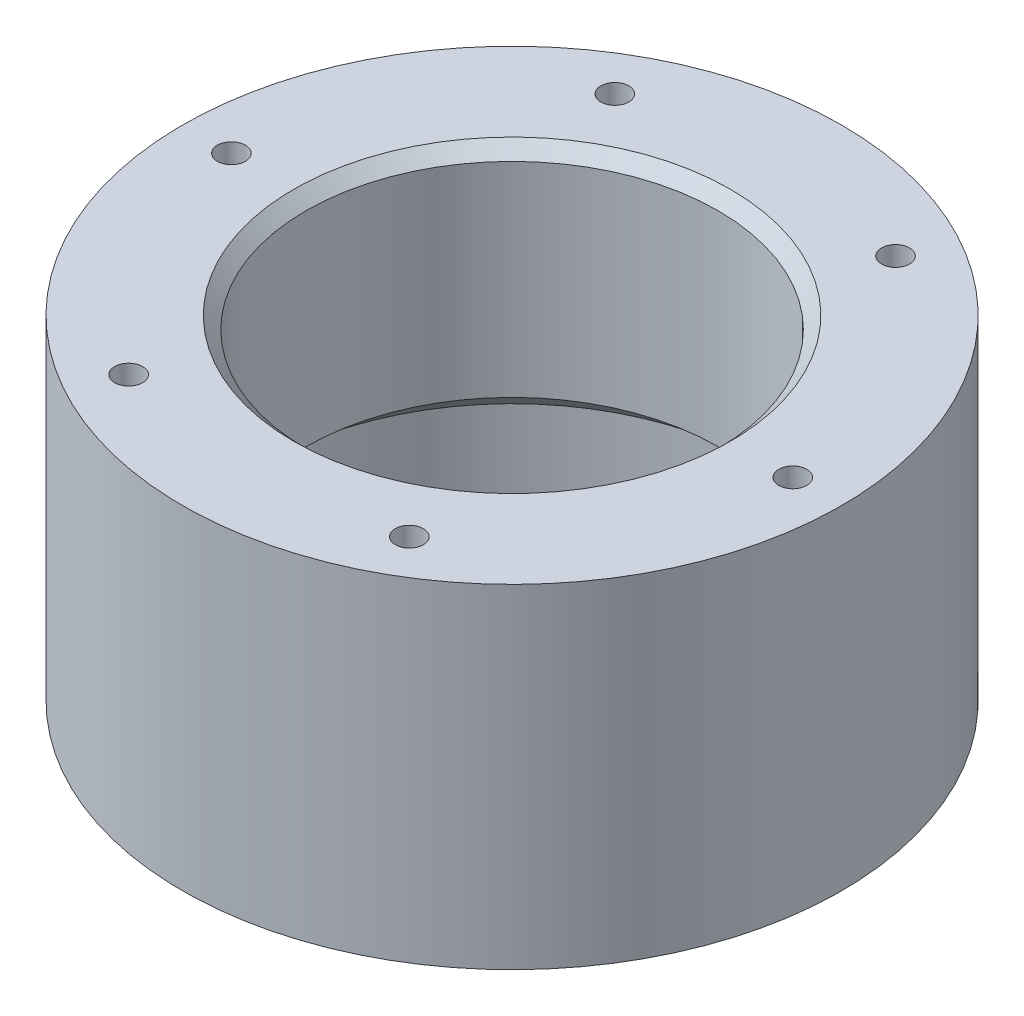
from build123d import *

# Parameters (mm, degrees)
OTW_R_GWINTOWANY_M81_D     = 6.8
OTW_R_GWINTOWANY_M81_DEPTH = 40
OTW_R_GWINTOWANY_M81_TIP   = 2.042926105


with BuildPart() as part:
    # Szkic1 → Obrót1 (revolve)
    with BuildSketch(Plane.XY, mode=Mode.PRIVATE) as obr_t1_sk:
        Polygon((-60, -4.527704194), (-60, 15.472295806), (-60, 76.472295806), (-80, 76.472295806), (-80, -4.527704194), align=None)
        Polygon((-50, 23.863292118), (-50, 73.472295806), (-53, 76.472295806), (-60, 76.472295806), (-60, 15.472295806), align=None)
    revolve(obr_t1_sk.sketch.rotate(Axis((0, 0, 0), (0, 1, 0)), 270), axis=Axis((0, 0, 0), (0, 1, 0)))

    # Otwór gwintowany M81
    with Locations(Plane(origin=(-68.136728334, 76.472295806, 0), x_dir=(0, 0, 1), z_dir=(0, 1, 0))):
        with Locations((0, 0), (-59.008137668, 34.068364167), (-59.008137668, 102.205092501), (0, 136.273456668), (59.008137668, 102.205092501), (59.008137668, 34.068364167)):
            Hole(OTW_R_GWINTOWANY_M81_D / 2, depth=OTW_R_GWINTOWANY_M81_DEPTH)
            with Locations((0, 0, -(OTW_R_GWINTOWANY_M81_DEPTH + OTW_R_GWINTOWANY_M81_TIP / 2))):  # 118° drill point
                Cone(0, OTW_R_GWINTOWANY_M81_D / 2, OTW_R_GWINTOWANY_M81_TIP, mode=Mode.SUBTRACT)


solid = part.part
